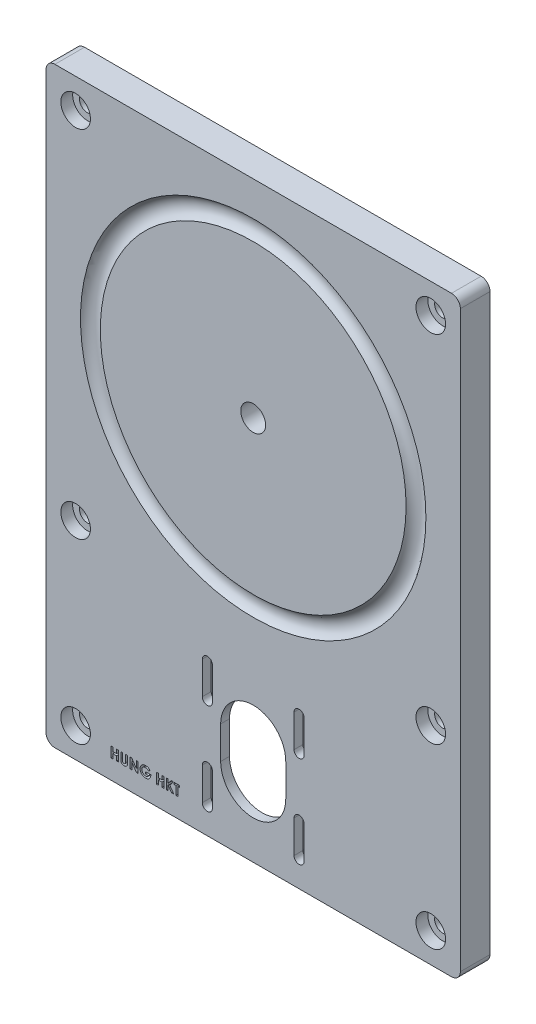
from build123d import *

# Parameters (mm, degrees)
SKETCH3_R           = 4.2
CUT_EXTRUDE1_DEPTH  = 38
BOSS_EXTRUDE2_START = -10
SKETCH4_R           = 65
SKETCH4_R_2         = 2.7
BOSS_EXTRUDE2_DEPTH = 10
CUT_EXTRUDE2_DEPTH  = 7
FILLET1_R           = 3
SKETCH6_R           = 5
CUT_EXTRUDE3_DEPTH  = 4


with BuildPart() as part:
    # Sketch1 → Revolve1 (revolve)
    with BuildSketch(Plane(origin=(0, 0, 0), x_dir=(1, 0, 0), z_dir=(0, 1, 0))):
        with BuildLine():
            Line((0, 10), (0, 0))
            Line((0, 0), (51.653359894, 0))
            ThreePointArc((51.653359894, 0), (55, 2), (58.346640106, 0))
            Line((58.346640106, 0), (65, 0))
            Line((65, 0), (65, 10))
            Line((65, 10), (0, 10))
        make_face()
    revolve(axis=Axis((0, 0, 0), (0, 0, -1)))

    # Sketch3 → Cut-Extrude1 (cut)
    with BuildSketch(Plane(origin=(0, 0, -10), x_dir=(-1, 0, 0), z_dir=(0, 0, -1))):
        Circle(SKETCH3_R)
    extrude(amount=-CUT_EXTRUDE1_DEPTH, mode=Mode.SUBTRACT)

    # Sketch4 → Boss-Extrude2 (add)
    with BuildSketch(Plane.XY.offset(BOSS_EXTRUDE2_START)):
        Polygon((-70, 0), (-70, 70), (70, 70), (70, -130), (-70, -130), align=None)
        Circle(SKETCH4_R, mode=Mode.SUBTRACT)
        with Locations((-60, 60)):
            Circle(SKETCH4_R_2, mode=Mode.SUBTRACT)
        with Locations((60, 60)):
            Circle(SKETCH4_R_2, mode=Mode.SUBTRACT)
        with Locations((-60, -60)):
            Circle(SKETCH4_R_2, mode=Mode.SUBTRACT)
        with Locations((60, -60)):
            Circle(SKETCH4_R_2, mode=Mode.SUBTRACT)
        with Locations((60, -120)):
            Circle(SKETCH4_R_2, mode=Mode.SUBTRACT)
        with Locations((-60, -120)):
            Circle(SKETCH4_R_2, mode=Mode.SUBTRACT)
        with BuildLine():
            Line((-17.2, -90.140709086), (-17.2, -79.140709086))
            ThreePointArc((-17.2, -79.140709086), (-15.5, -77.440709086), (-13.8, -79.140709086))
            Line((-13.8, -79.140709086), (-13.8, -90.140709086))
            ThreePointArc((-13.8, -90.140709086), (-15.5, -91.840709086), (-17.2, -90.140709086))
        make_face(mode=Mode.SUBTRACT)
        with BuildLine():
            Line((-17.2, -110.140709086), (-17.2, -121.140709086))
            ThreePointArc((-17.2, -121.140709086), (-15.5, -122.840709086), (-13.8, -121.140709086))
            Line((-13.8, -121.140709086), (-13.8, -110.140709086))
            ThreePointArc((-13.8, -110.140709086), (-15.5, -108.440709086), (-17.2, -110.140709086))
        make_face(mode=Mode.SUBTRACT)
        with BuildLine():
            Line((13.8, -79.140709086), (13.8, -90.140709086))
            ThreePointArc((13.8, -90.140709086), (15.5, -91.840709086), (17.2, -90.140709086))
            Line((17.2, -90.140709086), (17.2, -79.140709086))
            ThreePointArc((17.2, -79.140709086), (15.5, -77.440709086), (13.8, -79.140709086))
        make_face(mode=Mode.SUBTRACT)
        with BuildLine():
            Line((-11, -95), (-11, -106))
            ThreePointArc((-11, -106), (0, -117), (11, -106))
            Line((11, -106), (11, -95))
            ThreePointArc((11, -95), (0, -84), (-11, -95))
        make_face(mode=Mode.SUBTRACT)
        with BuildLine():
            Line((13.8, -110.140709086), (13.8, -121.140709086))
            ThreePointArc((13.8, -121.140709086), (15.5, -122.840709086), (17.2, -121.140709086))
            Line((17.2, -121.140709086), (17.2, -110.140709086))
            ThreePointArc((17.2, -110.140709086), (15.5, -108.440709086), (13.8, -110.140709086))
        make_face(mode=Mode.SUBTRACT)
    extrude(amount=BOSS_EXTRUDE2_DEPTH)

    # Sketch5 → Cut-Extrude2 (cut)
    with BuildSketch(Plane(origin=(0, 0, -10), x_dir=(-1, 0, 0), z_dir=(0, 0, -1))):
        Polygon((21.535859029, -84.5), (21.535859029, -72.999559469), (-21.535859029, -72.999559469), (-21.535859029, -84.5), (-21.535859029, -127.5), (21.535859029, -127.5), align=None)
    extrude(amount=-CUT_EXTRUDE2_DEPTH, mode=Mode.SUBTRACT)

    # Fillet1
    fillet1_edges = [part.edges().sort_by_distance(p)[0] for p in [
        (-70, -130, -5),
        (-70, 70, -5),
        (70, 70, -5),
        (70, -130, -5),
    ]]
    fillet(fillet1_edges, radius=FILLET1_R)

    # Sketch6 → Cut-Extrude3 (cut)
    with BuildSketch(Plane.XY):
        with Locations((-60, 60)):
            Circle(SKETCH6_R)
        with Locations((60, 60)):
            Circle(SKETCH6_R)
        with Locations((-60, -60)):
            Circle(SKETCH6_R)
        with Locations((60, -60)):
            Circle(SKETCH6_R)
        with Locations((-60, -120)):
            Circle(SKETCH6_R)
        with Locations((60, -120)):
            Circle(SKETCH6_R)
        Polygon((-48.01854064, -119.957848259), (-47.390335512, -119.957848259), (-47.390335512, -121.304002105), (-46.178797051, -121.304002105), (-46.178797051, -119.957848259), (-45.550591923, -119.957848259), (-45.550591923, -123.457848259), (-46.178797051, -123.457848259), (-46.178797051, -121.932207234), (-47.390335512, -121.932207234), (-47.390335512, -123.457848259), (-48.01854064, -123.457848259), align=None)
        with BuildLine():
            Line((-44.742899615, -119.957848259), (-44.114694487, -119.957848259))
            Line((-44.114694487, -119.957848259), (-44.114694487, -122.235091849))
            add(Edge.make_bspline(
                [(-44.114694487, -122.235091849), (-44.114660328, -122.258701323), (-44.114594351, -122.304302778), (-44.111291499, -122.369725935), (-44.108269162, -122.429863515), (-44.102816009, -122.484649679), (-44.094759832, -122.534107864), (-44.086958824, -122.578555771), (-44.076400931, -122.61719761), (-44.060534106, -122.661182139), (-44.036088537, -122.710601161), (-43.996145834, -122.762106799), (-43.950055371, -122.809113169), (-43.894813297, -122.848239491), (-43.832726091, -122.879889158), (-43.764134895, -122.90333806), (-43.689136398, -122.916372535), (-43.637279052, -122.918362487), (-43.610587916, -122.919386721)],
                knots=[0, 0, 0, 0, 1.155499968, 2.231836252, 3.205919964, 4.102923608, 4.924856345, 5.658536265, 6.31071849, 6.882491295, 7.94666036, 8.992281882, 10.060072772, 11.158554251, 12.289267114, 13.461410017, 14.693379945, 16, 16, 16, 16], degree=3))
            add(Edge.make_bspline(
                [(-43.610587916, -122.919386721), (-43.582231879, -122.918559271), (-43.526942406, -122.916945884), (-43.447417302, -122.901108746), (-43.373736842, -122.875890599), (-43.307461092, -122.839897875), (-43.248656009, -122.796754288), (-43.198878738, -122.747557079), (-43.159594698, -122.692208124), (-43.133990823, -122.641144499), (-43.119615508, -122.594144878), (-43.108840493, -122.5521525), (-43.100941215, -122.502605651), (-43.093774731, -122.446278111), (-43.089468226, -122.382586437), (-43.084798523, -122.312042843), (-43.083087034, -122.234164653), (-43.082795323, -122.179936608), (-43.082643205, -122.151658355)],
                knots=[0, 0, 0, 0, 1.261321664, 2.459363699, 3.594844139, 4.716940403, 5.803436589, 6.833651888, 7.818396249, 8.814403945, 9.360733334, 10.004355033, 10.743453831, 11.592799886, 12.532235708, 13.585170094, 14.740740724, 16, 16, 16, 16], degree=3))
            Line((-43.082643205, -122.151658355), (-43.082643205, -119.957848259))
            Line((-43.082643205, -119.957848259), (-42.454438076, -119.957848259))
            Line((-42.454438076, -119.957848259), (-42.454438076, -122.045788964))
            add(Edge.make_bspline(
                [(-42.454438076, -122.045788964), (-42.454525314, -122.088090543), (-42.454693064, -122.169432354), (-42.457269192, -122.28632626), (-42.462753302, -122.393090093), (-42.467359322, -122.489755048), (-42.476273549, -122.576190902), (-42.485560082, -122.652766761), (-42.497396567, -122.719211257), (-42.515008544, -122.794850241), (-42.545401604, -122.881945761), (-42.594399202, -122.982232477), (-42.65659848, -123.080419247), (-42.730114919, -123.175425948), (-42.813121702, -123.263684111), (-42.903778394, -123.341163354), (-43.000644683, -123.40670244), (-43.104732753, -123.458698857), (-43.21595402, -123.499252142), (-43.335408935, -123.526501907), (-43.463016039, -123.544912191), (-43.551156678, -123.546680725), (-43.59656548, -123.547591849)],
                knots=[0, 0, 0, 0, 1.170808336, 2.251350247, 3.235597562, 4.129743112, 4.929140599, 5.639994148, 6.264258765, 6.79612947, 7.788252245, 8.809469599, 9.879094798, 10.999557536, 12.129761673, 13.226370002, 14.293821979, 15.358369427, 16.438775801, 17.562147481, 18.744053101, 20, 20, 20, 20], degree=3))
            add(Edge.make_bspline(
                [(-43.59656548, -123.547591849), (-43.626735992, -123.547083667), (-43.686261792, -123.546081033), (-43.773804923, -123.537240425), (-43.858432557, -123.524212692), (-43.939985677, -123.505206572), (-44.018747341, -123.480654215), (-44.094696622, -123.450431973), (-44.167551275, -123.414708422), (-44.236903615, -123.373812141), (-44.302668299, -123.329589854), (-44.362773825, -123.280567588), (-44.419288567, -123.230370723), (-44.470579835, -123.176886763), (-44.517032874, -123.120677198), (-44.558552013, -123.06161464), (-44.59507557, -122.999704333), (-44.627522273, -122.93383035), (-44.655293484, -122.860644551), (-44.678705658, -122.77754369), (-44.699159084, -122.683225242), (-44.714358864, -122.577476714), (-44.728139073, -122.46064664), (-44.736861186, -122.33243066), (-44.741424116, -122.192825097), (-44.742395354, -122.096039453), (-44.742899615, -122.045788964)],
                knots=[0, 0, 0, 0, 1.001158378, 1.975264943, 2.917723546, 3.841610987, 4.75185031, 5.653588123, 6.552117133, 7.442167995, 8.324307438, 9.179605724, 10.014504199, 10.831958861, 11.636465792, 12.43274043, 13.225645099, 14.020104002, 14.867201867, 15.819789774, 16.883317127, 18.068162734, 19.364263498, 20.787406516, 22.332041935, 24, 24, 24, 24], degree=3))
            Line((-44.742899615, -122.045788964), (-44.742899615, -119.957848259))
        make_face()
        Polygon((-41.646745769, -119.957848259), (-41.08094048, -119.957848259), (-39.492899615, -122.261033355), (-39.492899615, -119.957848259), (-38.864694487, -119.957848259), (-38.864694487, -123.457848259), (-39.434706506, -123.457848259), (-41.01854064, -121.161674381), (-41.01854064, -123.457848259), (-41.646745769, -123.457848259), align=None)
        with BuildLine():
            Line((-34.849369967, -120.514538964), (-35.324730544, -120.969567009))
            add(Edge.make_bspline(
                [(-35.324730544, -120.969567009), (-35.362365671, -120.931886789), (-35.436212002, -120.857951977), (-35.556978439, -120.761720738), (-35.682055816, -120.679905161), (-35.811855813, -120.61263067), (-35.946559242, -120.560446726), (-36.085900276, -120.523117882), (-36.230105605, -120.500977511), (-36.327726175, -120.497877935), (-36.377114358, -120.496309798)],
                knots=[0, 0, 0, 0, 1.075575784, 2.110457258, 3.113929901, 4.09197124, 5.059417775, 6.02750972, 7.002078037, 8, 8, 8, 8], degree=3))
            add(Edge.make_bspline(
                [(-36.377114358, -120.496309798), (-36.419932403, -120.497408584), (-36.504009388, -120.499566148), (-36.627552419, -120.515950541), (-36.745605353, -120.543319932), (-36.858725921, -120.581235653), (-36.966223482, -120.63057599), (-37.068720897, -120.690579433), (-37.165587397, -120.761705012), (-37.256060227, -120.842604435), (-37.33843603, -120.93093027), (-37.410354455, -121.025470147), (-37.471613503, -121.124461921), (-37.522042194, -121.228412051), (-37.560412943, -121.337160991), (-37.587804637, -121.450629797), (-37.605191551, -121.568488713), (-37.607244426, -121.648893286), (-37.60828423, -121.689619093)],
                knots=[0, 0, 0, 0, 1.075001177, 2.110859044, 3.123021556, 4.114053297, 5.101481495, 6.087880186, 7.091499647, 8.114004866, 9.131394192, 10.11971144, 11.092043119, 12.050101265, 13.015322563, 13.981809771, 14.977764287, 16, 16, 16, 16], degree=3))
            add(Edge.make_bspline(
                [(-37.60828423, -121.689619093), (-37.607314351, -121.731754474), (-37.605403555, -121.814766945), (-37.587048206, -121.936591314), (-37.558768631, -122.053795135), (-37.517374873, -122.165508785), (-37.466431693, -122.273262582), (-37.401827347, -122.374969235), (-37.326492215, -122.472181914), (-37.24056091, -122.563208092), (-37.147089841, -122.647112321), (-37.045857632, -122.719490269), (-36.939944388, -122.781936815), (-36.827640664, -122.831392461), (-36.71089572, -122.871099926), (-36.588525427, -122.899097097), (-36.460805334, -122.916273264), (-36.373663066, -122.918338571), (-36.329438076, -122.919386721)],
                knots=[0, 0, 0, 0, 1.022067601, 2.013613092, 2.983553406, 3.943623673, 4.90013463, 5.87121881, 6.861774014, 7.881098904, 8.905697761, 9.905387765, 10.89678721, 11.884561068, 12.87834324, 13.885584958, 14.926927371, 16, 16, 16, 16], degree=3))
            add(Edge.make_bspline(
                [(-36.329438076, -122.919386721), (-36.300671359, -122.919127164), (-36.244195891, -122.918617595), (-36.161356003, -122.910345867), (-36.082015288, -122.898520471), (-36.005866482, -122.88286505), (-35.933678481, -122.860709821), (-35.864451795, -122.834802008), (-35.79859203, -122.804225623), (-35.736456272, -122.767925724), (-35.67711976, -122.727237974), (-35.621137896, -122.680682536), (-35.56752869, -122.629309063), (-35.516918561, -122.572489956), (-35.4701641, -122.509717185), (-35.425767412, -122.442144283), (-35.384236831, -122.369100631), (-35.359697506, -122.317520904), (-35.347166442, -122.291181593)],
                knots=[0, 0, 0, 0, 1.109579412, 2.178351274, 3.208885622, 4.204702371, 5.174744997, 6.119429583, 7.05542196, 7.97267548, 8.893247984, 9.828544973, 10.778894627, 11.756245826, 12.760884819, 13.796418446, 14.874735809, 16, 16, 16, 16], degree=3))
            Line((-35.347166442, -122.291181593), (-36.351873974, -122.291181593))
            Line((-36.351873974, -122.291181593), (-36.351873974, -121.662976464))
            Line((-36.351873974, -121.662976464), (-34.606781826, -121.662976464))
            Line((-34.606781826, -121.662976464), (-34.601873974, -121.812315407))
            add(Edge.make_bspline(
                [(-34.601873974, -121.812315407), (-34.602504596, -121.850669436), (-34.603764716, -121.927309049), (-34.615280888, -122.041412377), (-34.634357252, -122.15400236), (-34.660436467, -122.264965917), (-34.69312032, -122.374847364), (-34.734802465, -122.482594494), (-34.783612001, -122.588938012), (-34.838299624, -122.69342604), (-34.899752777, -122.793685144), (-34.96591612, -122.888617281), (-35.035846449, -122.978058144), (-35.111064719, -123.060761596), (-35.190399659, -123.137422384), (-35.274007441, -123.207745585), (-35.36218378, -123.2717907), (-35.454461571, -123.330098764), (-35.551366426, -123.381202343), (-35.652365562, -123.425655676), (-35.757306483, -123.463408954), (-35.866460123, -123.494358428), (-35.979611694, -123.51823841), (-36.096763621, -123.534612945), (-36.217980244, -123.545739626), (-36.300198916, -123.546966977), (-36.342058269, -123.547591849)],
                knots=[0, 0, 0, 0, 1.006889344, 2.011981806, 3.007738725, 4.003571281, 5.003404394, 6.015442001, 7.03424805, 8.074616296, 9.110249922, 10.119753985, 11.111721717, 12.089233633, 13.052717867, 14.006597561, 14.955430184, 15.912305663, 16.870361111, 17.829300583, 18.807640451, 19.796414044, 20.806216501, 21.841577364, 22.90109906, 24, 24, 24, 24], degree=3))
            add(Edge.make_bspline(
                [(-36.342058269, -123.547591849), (-36.386719361, -123.546974776), (-36.475250965, -123.545751555), (-36.606156808, -123.534295251), (-36.733264991, -123.515387361), (-36.856607218, -123.489219488), (-36.976469864, -123.456651479), (-37.092646988, -123.415770923), (-37.204900975, -123.367142211), (-37.313567973, -123.312053047), (-37.4172591, -123.249577136), (-37.515741968, -123.180810001), (-37.608479038, -123.105309295), (-37.696420225, -123.024338915), (-37.777510884, -122.935908602), (-37.854772946, -122.842884812), (-37.924463328, -122.741855802), (-37.989578511, -122.636096963), (-38.04742736, -122.525652614), (-38.09801701, -122.412565479), (-38.141159835, -122.297490334), (-38.175178995, -122.17989135), (-38.202799367, -122.060588526), (-38.222562262, -121.939063042), (-38.233723291, -121.815330109), (-38.235563243, -121.732175169), (-38.236489358, -121.690320214)],
                knots=[0, 0, 0, 0, 1.084149091, 2.14910686, 3.187506334, 4.202448172, 5.208724393, 6.201130722, 7.189831603, 8.176984443, 9.156919086, 10.126598231, 11.090766514, 12.05840148, 13.026036446, 14.001772938, 14.991905635, 16.003017641, 17.015720547, 18.016462227, 19.009322657, 19.99686681, 20.986544154, 21.980959929, 22.983742515, 24, 24, 24, 24], degree=3))
            add(Edge.make_bspline(
                [(-38.236489358, -121.690320214), (-38.235249092, -121.633221112), (-38.232799933, -121.520467314), (-38.210117008, -121.354380254), (-38.174757707, -121.193707596), (-38.124013551, -121.039034498), (-38.058896814, -120.890147896), (-37.980329937, -120.746698273), (-37.886606274, -120.608838102), (-37.814057722, -120.523483509), (-37.777254583, -120.480183996)],
                knots=[0, 0, 0, 0, 1.034044851, 2.041932006, 3.031217818, 4.011390712, 4.986069675, 5.97149666, 6.970960976, 8, 8, 8, 8], degree=3))
            add(Edge.make_bspline(
                [(-37.777254583, -120.480183996), (-37.754403873, -120.455133916), (-37.709045558, -120.405409882), (-37.636540374, -120.336317326), (-37.562196438, -120.271367767), (-37.484984076, -120.21193842), (-37.405309177, -120.156728348), (-37.322942423, -120.106772508), (-37.238315892, -120.060480279), (-37.1507696, -120.020215518), (-37.060761862, -119.984114801), (-36.967894049, -119.953568519), (-36.872861722, -119.926511773), (-36.774823366, -119.905928529), (-36.674769403, -119.888788374), (-36.571989616, -119.877300144), (-36.466764086, -119.86888009), (-36.395594829, -119.868365187), (-36.359586314, -119.868104669)],
                knots=[0, 0, 0, 0, 1.020590567, 2.025856924, 3.013483481, 3.991664875, 4.957826714, 5.930500614, 6.890802512, 7.860442893, 8.829981142, 9.809047939, 10.802672283, 11.803273349, 12.823572789, 13.857849586, 14.916166035, 16, 16, 16, 16], degree=3))
            add(Edge.make_bspline(
                [(-36.359586314, -119.868104669), (-36.321945724, -119.868685152), (-36.247054771, -119.869840099), (-36.135704327, -119.877831581), (-36.025901172, -119.890160553), (-35.918108028, -119.908654716), (-35.811963139, -119.931461868), (-35.708015937, -119.960683475), (-35.605588297, -119.993884483), (-35.53890829, -120.02035478), (-35.505619967, -120.033569413)],
                knots=[0, 0, 0, 0, 1.03180557, 2.052914215, 3.058998889, 4.059601663, 5.049854447, 6.033765722, 7.018406786, 8, 8, 8, 8], degree=3))
            add(Edge.make_bspline(
                [(-35.505619967, -120.033569413), (-35.477611961, -120.045782112), (-35.420644452, -120.070622405), (-35.337763747, -120.116068885), (-35.254680542, -120.166451524), (-35.172291347, -120.223612429), (-35.090721699, -120.287444681), (-35.009119925, -120.356940062), (-34.928319046, -120.432908927), (-34.876027142, -120.486976563), (-34.849369967, -120.514538964)],
                knots=[0, 0, 0, 0, 0.894392155, 1.819168899, 2.76525314, 3.739198753, 4.75366411, 5.797420238, 6.877176959, 8, 8, 8, 8], degree=3))
        make_face()
        Polygon((-32.627514999, -119.957848259), (-31.999309871, -119.957848259), (-31.999309871, -121.304002105), (-30.78777141, -121.304002105), (-30.78777141, -119.957848259), (-30.159566282, -119.957848259), (-30.159566282, -123.457848259), (-30.78777141, -123.457848259), (-30.78777141, -121.932207234), (-31.999309871, -121.932207234), (-31.999309871, -123.457848259), (-32.627514999, -123.457848259), align=None)
        Polygon((-29.351873974, -119.957848259), (-28.723668846, -119.957848259), (-28.723668846, -121.189719253), (-27.730880384, -119.957848259), (-26.937911634, -119.957848259), (-28.185207307, -121.505925182), (-26.816617564, -123.457848259), (-27.57312798, -123.457848259), (-28.723668846, -121.816522137), (-28.723668846, -123.457848259), (-29.351873974, -123.457848259), align=None)
        Polygon((-26.704438076, -119.957848259), (-24.819822692, -119.957848259), (-24.819822692, -120.586053387), (-25.44802782, -120.586053387), (-25.44802782, -123.457848259), (-26.076232948, -123.457848259), (-26.076232948, -120.586053387), (-26.704438076, -120.586053387), align=None)
    extrude(amount=-CUT_EXTRUDE3_DEPTH, mode=Mode.SUBTRACT)


solid = part.part
